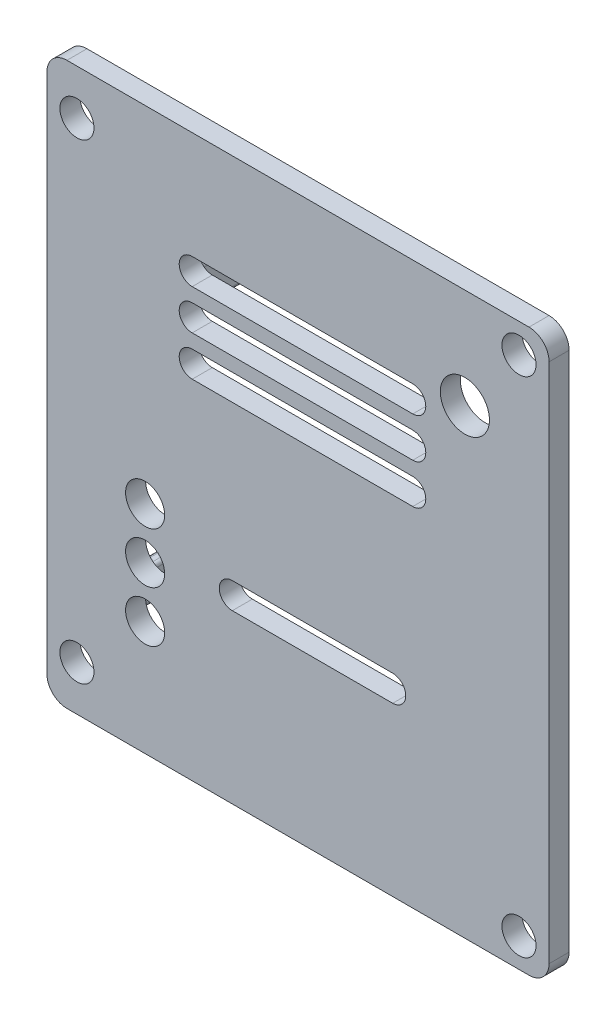
from build123d import *

# Parameters (mm, degrees)
CLEAR_GUARD_2MM_SKETCH_R                 = 1.7
CLEAR_GUARD_2MM_DEPTH                    = 2
OPENINGS_VENT_AND_TRIM_ACCESS_SKETCH_R   = 2.45
OPENINGS_VENT_AND_TRIM_ACCESS_SKETCH_R_2 = 1.95
OPENINGS_VENT_AND_TRIM_ACCESS_DEPTH      = 2
PCB_END_STOPS_START                      = -14.5
PCB_END_STOPS_DEPTH                      = 14.5


with BuildPart() as part:
    # Clear_guard_2mm_Sketch → Clear_guard_2mm (new body)
    with BuildSketch(Plane.XY):
        with BuildLine():
            Line((-26.5, -28), (19.6, -28))
            ThreePointArc((19.6, -28), (21.014213562, -27.414213562), (21.6, -26))
            Line((21.6, -26), (21.6, 26))
            ThreePointArc((21.6, 26), (21.014213562, 27.414213562), (19.6, 28))
            Line((19.6, 28), (-26.5, 28))
            ThreePointArc((-26.5, 28), (-27.914213562, 27.414213562), (-28.5, 26))
            Line((-28.5, 26), (-28.5, -26))
            ThreePointArc((-28.5, -26), (-27.914213562, -27.414213562), (-26.5, -28))
        make_face()
        with Locations((-25.5, -23.5)):
            Circle(CLEAR_GUARD_2MM_SKETCH_R, mode=Mode.SUBTRACT)
        with Locations((18.6, -25.1)):
            Circle(CLEAR_GUARD_2MM_SKETCH_R, mode=Mode.SUBTRACT)
        with Locations((-25.5, 23.5)):
            Circle(CLEAR_GUARD_2MM_SKETCH_R, mode=Mode.SUBTRACT)
        with Locations((18.6, 25.1)):
            Circle(CLEAR_GUARD_2MM_SKETCH_R, mode=Mode.SUBTRACT)
    extrude(amount=CLEAR_GUARD_2MM_DEPTH)

    # Openings_vent_and_trim_access_Sketch → Openings_vent_and_trim_access (cut)
    with BuildSketch(Plane.XY):
        with Locations((13.2, 18)):
            Circle(OPENINGS_VENT_AND_TRIM_ACCESS_SKETCH_R)
        with Locations((-18.7, -16.58)):
            Circle(OPENINGS_VENT_AND_TRIM_ACCESS_SKETCH_R_2)
        with Locations((-18.7, -11.5)):
            Circle(OPENINGS_VENT_AND_TRIM_ACCESS_SKETCH_R_2)
        with Locations((-18.7, -6.42)):
            Circle(OPENINGS_VENT_AND_TRIM_ACCESS_SKETCH_R_2)
        with BuildLine():
            Line((-14, 6.7), (8, 6.7))
            ThreePointArc((8, 6.7), (9.3, 8), (8, 9.3))
            Line((8, 9.3), (-14, 9.3))
            ThreePointArc((-14, 9.3), (-15.3, 8), (-14, 6.7))
        make_face()
        with BuildLine():
            Line((-14, 10.7), (8, 10.7))
            ThreePointArc((8, 10.7), (9.3, 12), (8, 13.3))
            Line((8, 13.3), (-14, 13.3))
            ThreePointArc((-14, 13.3), (-15.3, 12), (-14, 10.7))
        make_face()
        with BuildLine():
            Line((-14, 14.7), (8, 14.7))
            ThreePointArc((8, 14.7), (9.3, 16), (8, 17.3))
            Line((8, 17.3), (-14, 17.3))
            ThreePointArc((-14, 17.3), (-15.3, 16), (-14, 14.7))
        make_face()
        with BuildLine():
            Line((-10, -11.3), (6, -11.3))
            ThreePointArc((6, -11.3), (7.3, -10), (6, -8.7))
            Line((6, -8.7), (-10, -8.7))
            ThreePointArc((-10, -8.7), (-11.3, -10), (-10, -11.3))
        make_face()
    extrude(amount=OPENINGS_VENT_AND_TRIM_ACCESS_DEPTH, mode=Mode.SUBTRACT)

    # PCB_end_stops_Sketch → PCB_end_stops (add)
    with BuildSketch(Plane.XY.offset(PCB_END_STOPS_START)):
        with BuildLine():
            Line((-22.7, 4.5), (-22.2, 4.5))
            ThreePointArc((-22.2, 4.5), (-21.952512627, 4.602512627), (-21.85, 4.85))
            Line((-21.85, 4.85), (-21.85, 7.95))
            ThreePointArc((-21.85, 7.95), (-21.952512627, 8.197487373), (-22.2, 8.3))
            Line((-22.2, 8.3), (-22.7, 8.3))
            ThreePointArc((-22.7, 8.3), (-22.947487373, 8.197487373), (-23.05, 7.95))
            Line((-23.05, 7.95), (-23.05, 4.85))
            ThreePointArc((-23.05, 4.85), (-22.947487373, 4.602512627), (-22.7, 4.5))
        make_face()
        with BuildLine():
            Line((-24.7, -20.6), (-24.2, -20.6))
            ThreePointArc((-24.2, -20.6), (-23.952512627, -20.497487373), (-23.85, -20.25))
            Line((-23.85, -20.25), (-23.85, -17.65))
            ThreePointArc((-23.85, -17.65), (-23.952512627, -17.402512627), (-24.2, -17.3))
            Line((-24.2, -17.3), (-24.7, -17.3))
            ThreePointArc((-24.7, -17.3), (-24.947487373, -17.402512627), (-25.05, -17.65))
            Line((-25.05, -17.65), (-25.05, -20.25))
            ThreePointArc((-25.05, -20.25), (-24.947487373, -20.497487373), (-24.7, -20.6))
        make_face()
    extrude(amount=PCB_END_STOPS_DEPTH)


solid = part.part
